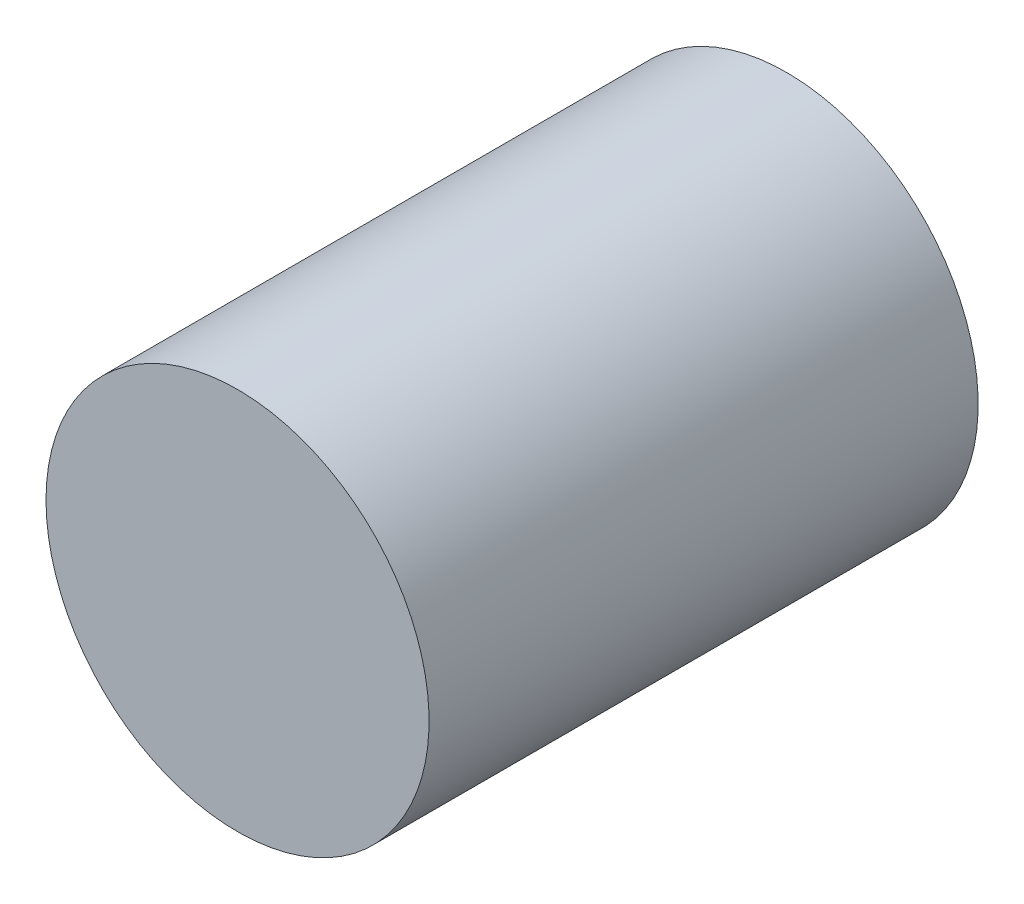
from build123d import *

# Parameters (mm, degrees)
SKETCH1_R           = 3
BOSS_EXTRUDE1_DEPTH = 8.6


with BuildPart() as part:
    # Sketch1 → Boss-Extrude1 (new body)
    with BuildSketch(Plane.XY):
        with Locations(Location((0, 0, 0), (0, 0, 180))):
            Circle(SKETCH1_R)
    extrude(amount=BOSS_EXTRUDE1_DEPTH)


solid = part.part
